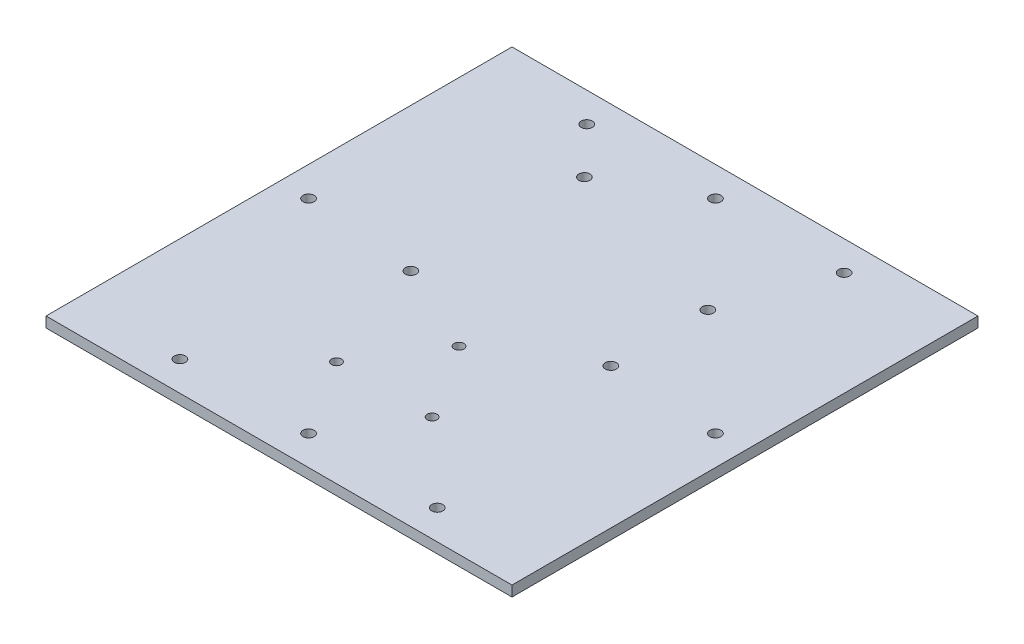
from build123d import *

# Parameters (mm, degrees)
SKETCH2_W           = 134
SKETCH2_H           = 134
SKETCH2_R           = 1.4
SKETCH2_R_2         = 1.6
BOSS_EXTRUDE2_DEPTH = 3


with BuildPart() as part:
    # Sketch2 → Boss-Extrude2 (new body)
    with BuildSketch(Plane(origin=(0, 0, 0), x_dir=(1, 0, 0), z_dir=(0, 1, 0))):
        Rectangle(SKETCH2_W, SKETCH2_H)
        with Locations(Location((-0.080384087, -15.14345336, 0), (0, 0, 270))):
            Circle(SKETCH2_R, mode=Mode.SUBTRACT)
        with Locations(Location((-13.830384087, -36.64345336, 0), (0, 0, 270))):
            Circle(SKETCH2_R, mode=Mode.SUBTRACT)
        with Locations(Location((13.669615913, -36.64345336, 0), (0, 0, 270))):
            Circle(SKETCH2_R, mode=Mode.SUBTRACT)
        with Locations(Location((-24.165395582, 44.984548377, 0), (0, 0, 270))):
            Circle(SKETCH2_R_2, mode=Mode.SUBTRACT)
        with Locations(Location((-25.765395582, -3.315451623, 0), (0, 0, 270))):
            Circle(SKETCH2_R_2, mode=Mode.SUBTRACT)
        with Locations(Location((26.634604418, 29.684548377, 0), (0, 0, 270))):
            Circle(SKETCH2_R_2, mode=Mode.SUBTRACT)
        with Locations(Location((26.634604418, 1.784548377, 0), (0, 0, 270))):
            Circle(SKETCH2_R_2, mode=Mode.SUBTRACT)
        with Locations(Location((0, 58.5, 0), (0, 0, 270))):
            Circle(SKETCH2_R_2, mode=Mode.SUBTRACT)
        with Locations(Location((-58.5, 0, 0), (0, 0, 270))):
            Circle(SKETCH2_R_2, mode=Mode.SUBTRACT)
        with Locations(Location((0, -58.5, 0), (0, 0, 270))):
            Circle(SKETCH2_R_2, mode=Mode.SUBTRACT)
        with Locations(Location((58.5, 0, 0), (0, 0, 270))):
            Circle(SKETCH2_R_2, mode=Mode.SUBTRACT)
        with Locations(Location((-37, 58.5, 0), (0, 0, 270))):
            Circle(SKETCH2_R_2, mode=Mode.SUBTRACT)
        with Locations(Location((37, 58.5, 0), (0, 0, 270))):
            Circle(SKETCH2_R_2, mode=Mode.SUBTRACT)
        with Locations(Location((-37, -58.5, 0), (0, 0, 270))):
            Circle(SKETCH2_R_2, mode=Mode.SUBTRACT)
        with Locations(Location((37, -58.5, 0), (0, 0, 270))):
            Circle(SKETCH2_R_2, mode=Mode.SUBTRACT)
    extrude(amount=BOSS_EXTRUDE2_DEPTH)


solid = part.part
